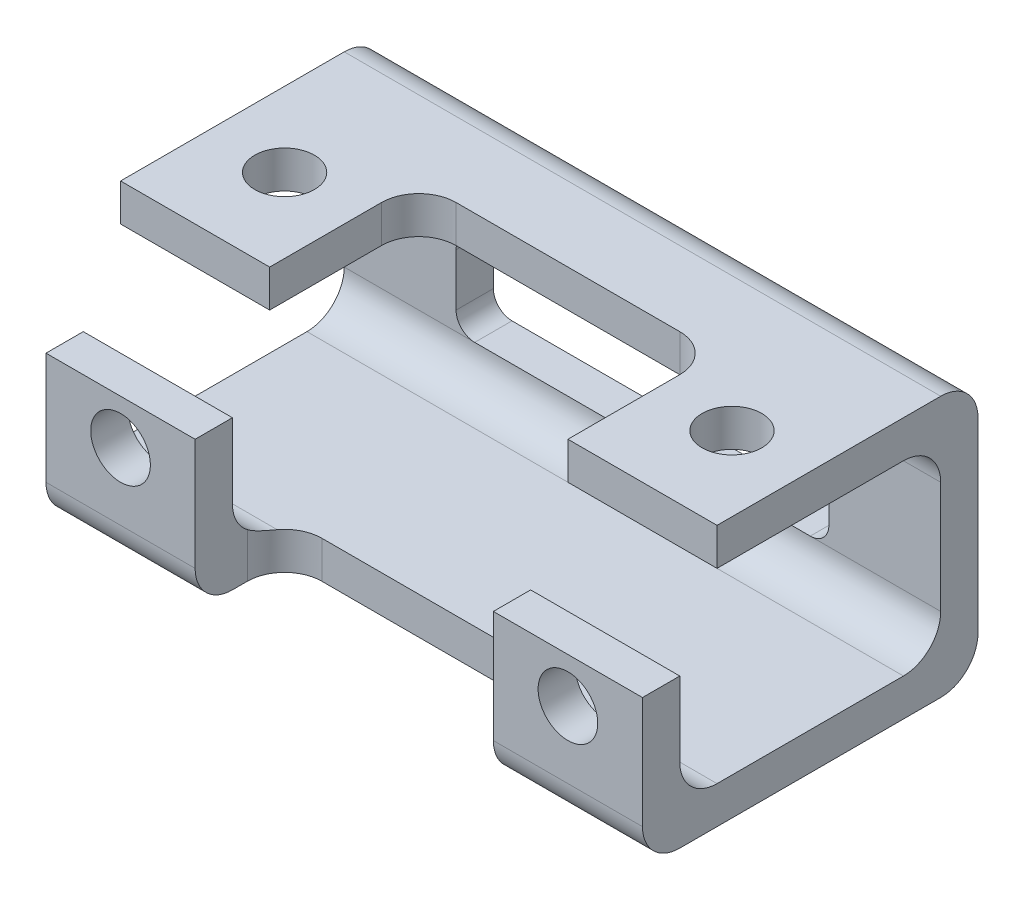
from build123d import *

# Parameters (mm, degrees)
BOSS_EXTRUDE1_DEPTH = 80
CUT_EXTRUDE1_REACH  = 100.234
CUT_EXTRUDE2_DEPTH  = 80
CUT_EXTRUDE3_REACH  = 98.047
SKETCH5_R           = 4
CUT_EXTRUDE4_REACH  = 100.234
SKETCH6_R           = 4


with BuildPart() as part:
    # Sketch1 → Boss-Extrude1 (new body)
    with BuildSketch(Plane(origin=(0, 0, 0), x_dir=(0, 0, -1), z_dir=(1, 0, 0))):
        with BuildLine():
            Line((-40, 20), (-40, 5))
            ThreePointArc((-40, 5), (-38.535533906, 1.464466094), (-35, 0))
            Line((-35, 0), (0, 0))
            ThreePointArc((0, 0), (3.535533906, 1.464466094), (5, 5))
            Line((5, 5), (5, 30))
            ThreePointArc((5, 30), (3.535533906, 33.535533906), (0, 35))
            Line((0, 35), (-30, 35))
            Line((-30, 35), (-30, 30))
            Line((-30, 30), (-5, 30))
            ThreePointArc((-5, 30), (-1.464466094, 28.535533906), (0, 25))
            Line((0, 25), (0, 10))
            ThreePointArc((0, 10), (-1.464466094, 6.464466094), (-5, 5))
            Line((-5, 5), (-30, 5))
            ThreePointArc((-30, 5), (-33.535533906, 6.464466094), (-35, 10))
            Line((-35, 10), (-35, 20))
            Line((-35, 20), (-40, 20))
        make_face()
    extrude(amount=BOSS_EXTRUDE1_DEPTH)

    # Sketch2 → Cut-Extrude1 (cut, up to next)
    with BuildSketch(Plane(origin=(0, 0, -5), x_dir=(-1, 0, 0), z_dir=(0, 0, -1)), mode=Mode.PRIVATE) as cut_extrude1_sk1:
        with BuildLine():
            Line((-62.5, 22), (-17.5, 22))
            ThreePointArc((-17.5, 22), (-15.732233047, 21.267766953), (-15, 19.5))
            Line((-15, 19.5), (-15, 12.5))
            ThreePointArc((-15, 12.5), (-15.732233047, 10.732233047), (-17.5, 10))
            Line((-17.5, 10), (-62.5, 10))
            ThreePointArc((-62.5, 10), (-64.267766953, 10.732233047), (-65, 12.5))
            Line((-65, 12.5), (-65, 19.5))
            ThreePointArc((-65, 19.5), (-64.267766953, 21.267766953), (-62.5, 22))
        make_face()
    cut_extrude1_tool1 = extrude(cut_extrude1_sk1.sketch, amount=-CUT_EXTRUDE1_REACH, mode=Mode.PRIVATE) & part.part
    add(cut_extrude1_tool1.solids().sort_by_distance((40, 16, -5))[0], mode=Mode.SUBTRACT)

    # Sketch4 → Cut-Extrude2 (cut)
    with BuildSketch(Plane(origin=(0, 35, 0), x_dir=(1, 0, 0), z_dir=(0, 1, 0))):
        with BuildLine():
            Line((20, -40), (20, -33))
            ThreePointArc((20, -33), (21.464466094, -29.464466094), (25, -28))
            Line((25, -28), (55, -28))
            ThreePointArc((55, -28), (58.535533906, -29.464466094), (60, -33))
            Line((60, -33), (60, -40))
            Line((60, -40), (20, -40))
        make_face()
    extrude(amount=-CUT_EXTRUDE2_DEPTH, mode=Mode.SUBTRACT)

    # Sketch5 → Cut-Extrude3 (cut, up to next)
    with BuildSketch(Plane(origin=(0, 35, 0), x_dir=(1, 0, 0), z_dir=(0, 1, 0)), mode=Mode.PRIVATE) as cut_extrude3_sk1:
        with Locations(Location((10, -18, 0), (0, 0, 270))):
            Circle(SKETCH5_R)
    cut_extrude3_tool1 = extrude(cut_extrude3_sk1.sketch, amount=-CUT_EXTRUDE3_REACH, mode=Mode.PRIVATE) & part.part
    # Sketch5 → Cut-Extrude3 (cut, up to next)
    with BuildSketch(Plane(origin=(0, 35, 0), x_dir=(1, 0, 0), z_dir=(0, 1, 0)), mode=Mode.PRIVATE) as cut_extrude3_sk2:
        with Locations(Location((70, -18, 0), (0, 0, 270))):
            Circle(SKETCH5_R)
    cut_extrude3_tool2 = extrude(cut_extrude3_sk2.sketch, amount=-CUT_EXTRUDE3_REACH, mode=Mode.PRIVATE) & part.part
    # Sketch5 → Cut-Extrude3 (cut, up to next)
    with BuildSketch(Plane(origin=(0, 35, 0), x_dir=(1, 0, 0), z_dir=(0, 1, 0)), mode=Mode.PRIVATE) as cut_extrude3_sk3:
        with BuildLine():
            Line((20, -30), (21, -30))
            ThreePointArc((21, -30), (22.763932023, -28.527864045), (25, -28))
            Line((25, -28), (55, -28))
            ThreePointArc((55, -28), (57.236067977, -28.527864045), (59, -30))
            Line((59, -30), (60, -30))
            Line((60, -30), (60, -15))
            ThreePointArc((60, -15), (58.535533906, -11.464466094), (55, -10))
            Line((55, -10), (25, -10))
            ThreePointArc((25, -10), (21.464466094, -11.464466094), (20, -15))
            Line((20, -15), (20, -30))
        make_face()
    cut_extrude3_tool3 = extrude(cut_extrude3_sk3.sketch, amount=-CUT_EXTRUDE3_REACH, mode=Mode.PRIVATE) & part.part
    add(cut_extrude3_tool1.solids().sort_by_distance((10, 35, 18))[0], mode=Mode.SUBTRACT)
    add(cut_extrude3_tool2.solids().sort_by_distance((70, 35, 18))[0], mode=Mode.SUBTRACT)
    add(cut_extrude3_tool3.solids().sort_by_distance((40, 35, 19.237715))[0], mode=Mode.SUBTRACT)

    # Sketch6 → Cut-Extrude4 (cut, up to next)
    with BuildSketch(Plane.XY.offset(40), mode=Mode.PRIVATE) as cut_extrude4_sk1:
        with Locations((10, 14)):
            Circle(SKETCH6_R)
    cut_extrude4_tool1 = extrude(cut_extrude4_sk1.sketch, amount=-CUT_EXTRUDE4_REACH, mode=Mode.PRIVATE) & part.part
    # Sketch6 → Cut-Extrude4 (cut, up to next)
    with BuildSketch(Plane.XY.offset(40), mode=Mode.PRIVATE) as cut_extrude4_sk2:
        with Locations((70, 14)):
            Circle(SKETCH6_R)
    cut_extrude4_tool2 = extrude(cut_extrude4_sk2.sketch, amount=-CUT_EXTRUDE4_REACH, mode=Mode.PRIVATE) & part.part
    add(cut_extrude4_tool1.solids().sort_by_distance((10, 14, 40))[0], mode=Mode.SUBTRACT)
    add(cut_extrude4_tool2.solids().sort_by_distance((70, 14, 40))[0], mode=Mode.SUBTRACT)


solid = part.part
